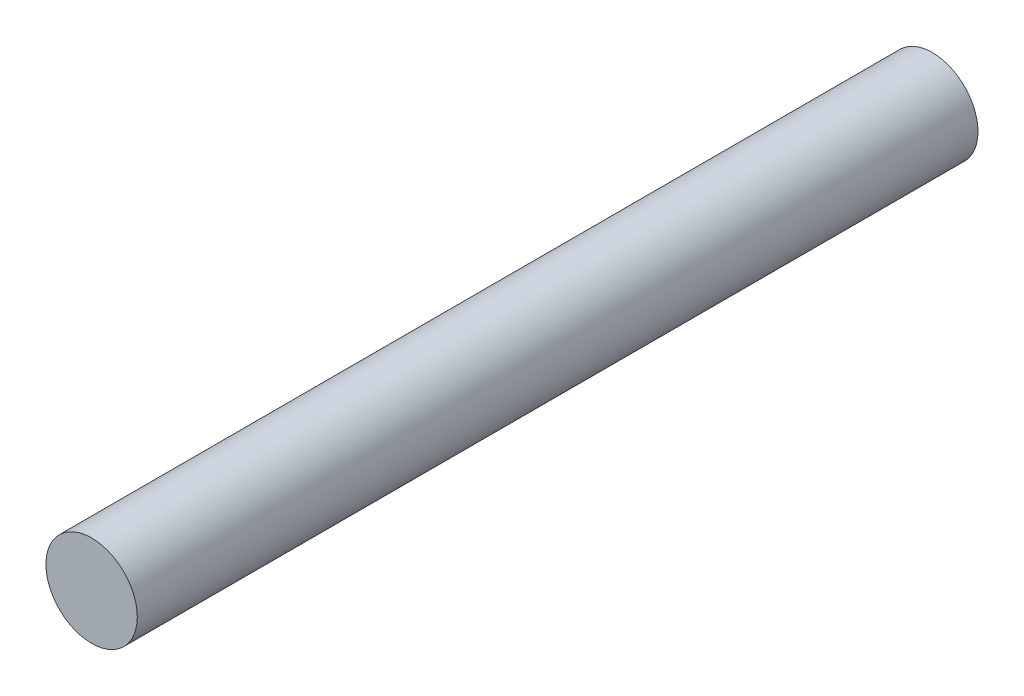
from build123d import *

# Parameters (mm, degrees)
BODY_SKETCH_R = 2.5
BODY_DEPTH    = 46


with BuildPart() as part:
    # Body sketch → Body (new body)
    with BuildSketch(Plane.XY):
        Circle(BODY_SKETCH_R)
    extrude(amount=BODY_DEPTH)


solid = part.part
